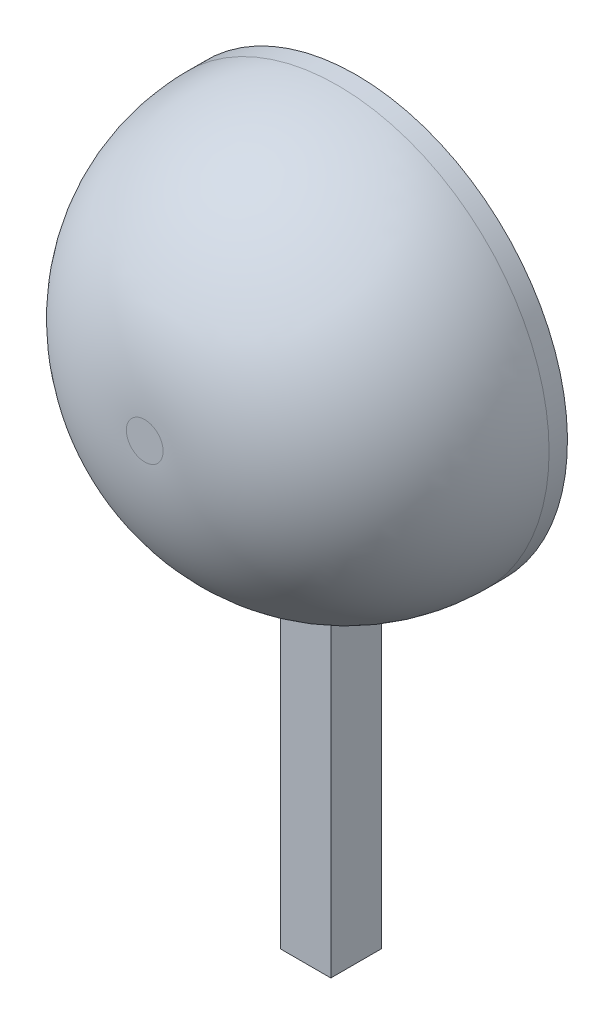
from build123d import *

# Parameters (mm, degrees)
SKETCH2_R                = 23
BOSS_EXTRUDE1_DEPTH      = 23
FILLET1_R                = 21
SHELL1_T                 = -3
FILLET2_R                = 1
BOSS_EXTRUDE3_DEPTH      = 2
BOSS_EXTRUDE3_DEPTH_BACK = 35
SKETCH5_W                = 5.5
SKETCH5_H                = 5.5


with BuildPart() as part:
    # Sketch2 → Boss-Extrude1 (new body)
    with BuildSketch(Plane.XY):
        with Locations((0, 23)):
            Circle(SKETCH2_R)
    extrude(amount=BOSS_EXTRUDE1_DEPTH)

    # Fillet1
    fillet1_edges = [part.edges().sort_by_distance(p)[0] for p in [
        (-23, 23, 23),
    ]]
    fillet(fillet1_edges, radius=FILLET1_R)

    # Shell1
    shell1_openings = [part.faces().sort_by_distance(p)[0] for p in [
        (0, 23, 0),
    ]]
    offset(amount=SHELL1_T, openings=shell1_openings, kind=Kind.INTERSECTION)

    # Fillet2
    fillet2_edges = [part.edges().sort_by_distance(p)[0] for p in [
        (-20, 23, 0),
    ]]
    fillet(fillet2_edges, radius=FILLET2_R)

    # Sketch5 → Boss-Extrude3 (add, two sides: drawn at the far end of the back side and taken through both)
    with BuildSketch(Plane(origin=(0, 0, 0), x_dir=(1, 0, 0), z_dir=(0, 1, 0)).offset(-BOSS_EXTRUDE3_DEPTH_BACK)):
        with Locations((0, -2.75)):
            Rectangle(SKETCH5_W, SKETCH5_H)
    extrude(amount=BOSS_EXTRUDE3_DEPTH + BOSS_EXTRUDE3_DEPTH_BACK)


solid = part.part
